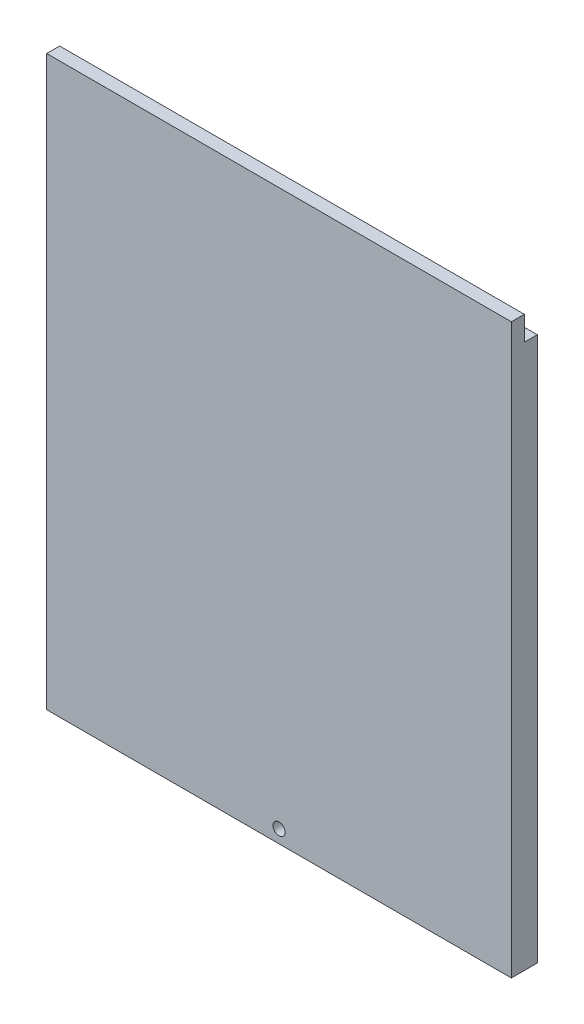
from build123d import *

# Parameters (mm, degrees)
SKETCH_1_W          = 53.8
SKETCH_1_H          = 63
EXTRUDE_1_DEPTH     = 3
SKETCH_2_W          = 53.8
SKETCH_2_H          = 1.5
EXTRUDE_2_DEPTH     = 2.8
SKETCH_3_R          = 1
CUT_EXTRUDE_1_DEPTH = 1.5
SKETCH_3_4_R        = 0.7
CUT_EXTRUDE_2_DEPTH = 44.693248906


with BuildPart() as part:
    # 草图1 → 凸台-拉伸1 (new body)
    with BuildSketch(Plane.XY):
        Rectangle(SKETCH_1_W, SKETCH_1_H)
    extrude(amount=EXTRUDE_1_DEPTH)

    # 草图2 → 凸台-拉伸2 (add)
    with BuildSketch(Plane(origin=(0, 31.5, 0), x_dir=(1, 0, 0), z_dir=(0, 1, 0))):
        with Locations((0, -2.25)):
            Rectangle(SKETCH_2_W, SKETCH_2_H)
    extrude(amount=EXTRUDE_2_DEPTH)

    # 草图3 → 切除-拉伸1 (cut)
    with BuildSketch(Plane(origin=(0, 0, 0), x_dir=(-1, 0, 0), z_dir=(0, 0, -1))):
        with Locations((0, -30)):
            Circle(SKETCH_3_R)
    extrude(amount=-CUT_EXTRUDE_1_DEPTH, mode=Mode.SUBTRACT)

    # 草图3<4> → 切除-拉伸2 (cut, through all)
    with BuildSketch(Plane(origin=(0, 0, 0), x_dir=(-1, 0, 0), z_dir=(0, 0, -1))):
        with Locations((0, -30)):
            Circle(SKETCH_3_4_R)
    extrude(amount=-CUT_EXTRUDE_2_DEPTH, mode=Mode.SUBTRACT)


solid = part.part
